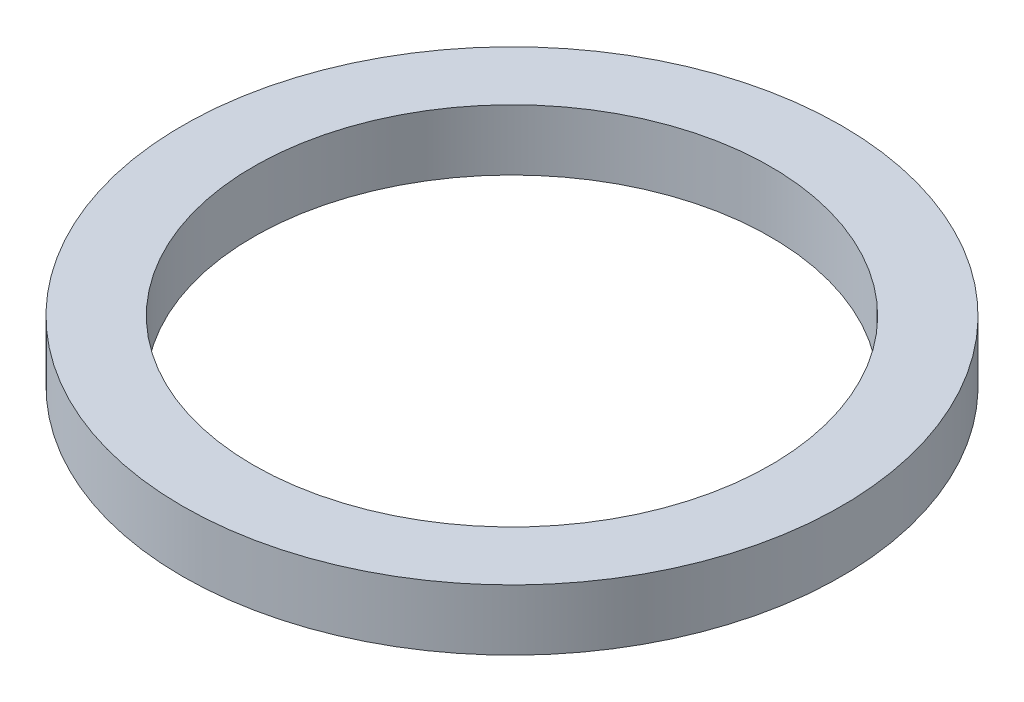
from build123d import *

# Parameters (mm, degrees)
SKETCH1_R      = 32.5
SKETCH1_R_2    = 25.5
EXTRUDE1_DEPTH = 6


with BuildPart() as part:
    # Sketch1 → Extrude1 (new body)
    with BuildSketch(Plane(origin=(0, 0, 0), x_dir=(1, 0, 0), z_dir=(0, 1, 0))):
        with Locations(Location((0, 0, 0), (0, 0, 270))):
            Circle(SKETCH1_R)
        with Locations(Location((0, 0, 0), (0, 0, 270))):
            Circle(SKETCH1_R_2, mode=Mode.SUBTRACT)
    extrude(amount=EXTRUDE1_DEPTH)


solid = part.part
